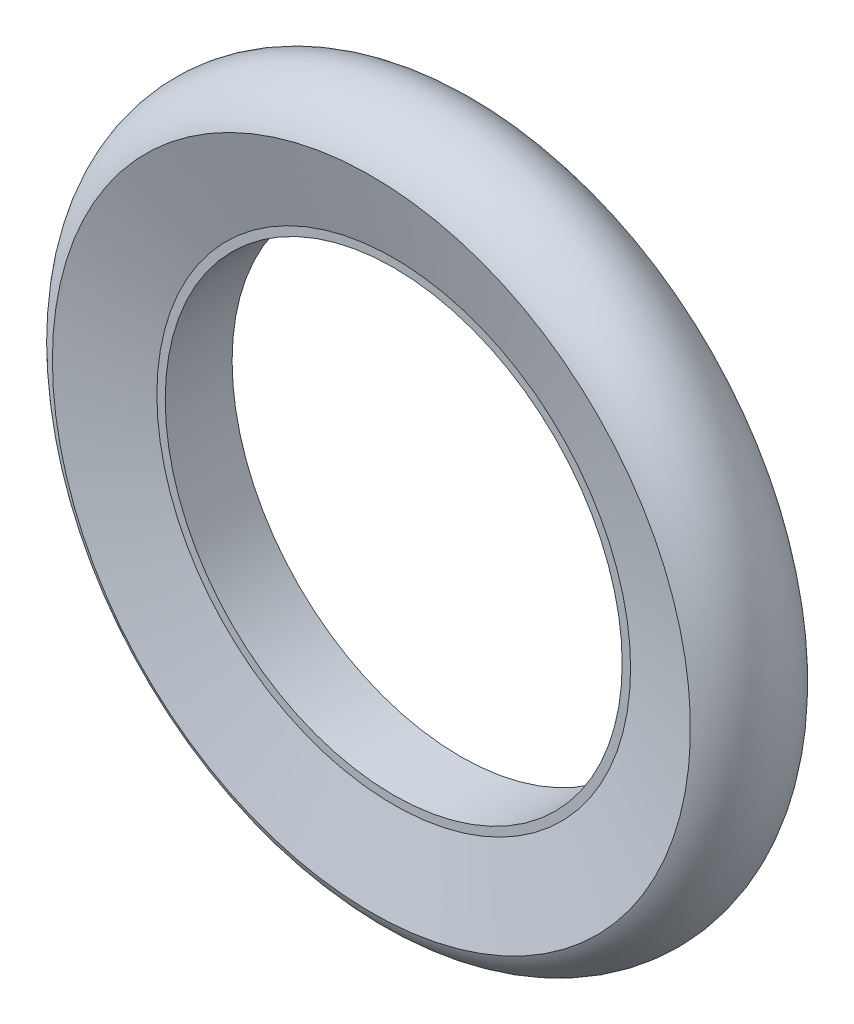
from build123d import *


with BuildPart() as part:
    # Sketch1 → Revolve1 (revolve)
    with BuildSketch(Plane(origin=(0, 0, 0), x_dir=(1, 0, 0), z_dir=(0, 1, 0))):
        with BuildLine():
            Line((-170, -24), (-229, -40))
            ThreePointArc((-229, -40), (-255, 0), (-229, 40))
            Line((-229, 40), (-170, 24))
            Line((-170, 24), (-164, 24))
            Line((-164, 24), (-164, -24))
            Line((-164, -24), (-170, -24))
        make_face()
    revolve(axis=Axis((0, 0, -36.464321623), (0, 0, 1)))


solid = part.part
